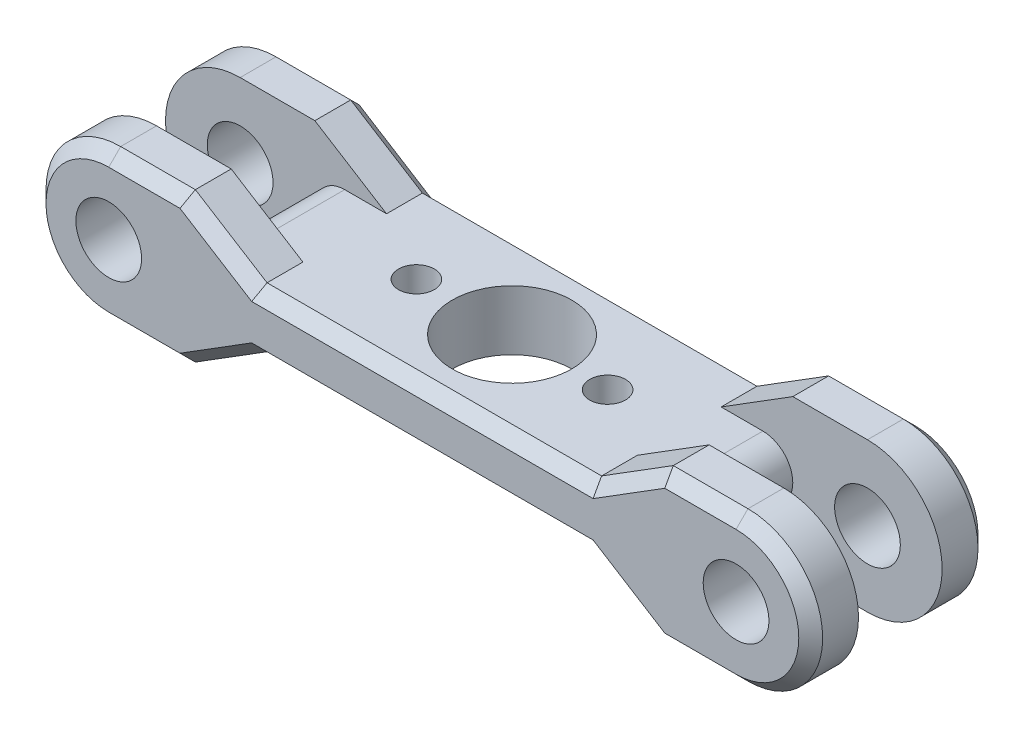
from build123d import *

# Parameters (mm, degrees)
SKETCH_1_W           = 40
SKETCH_1_H           = 15
EXTRUDE_1_DEPTH      = 5
CUT_EXTRUDE_START    = 5
SKETCH_2_R           = 5
SKETCH_2_R_2         = 1.5
CUT_EXTRUDE_1_DEPTH  = 5
EXTRUDE_3_DEPTH      = 8.75
EXTRUDE_3_DEPTH_BACK = 3.75
SKETCH_6_W           = 12.5
SKETCH_6_H           = 4
EXTRUDE_START        = 7.5
EXTRUDE_4_DEPTH      = 4
EXTRUDE_START_2      = -7.5
EXTRUDE_5_DEPTH      = 4
CUT_EXTRUDE_START_2  = 7.5
SKETCH_10_R          = 2.75
CUT_EXTRUDE_3_DEPTH  = 15
CUT_EXTRUDE_START_3  = -3.5
CUT_EXTRUDE_4_DEPTH  = 7
CHAMFER_1_SIZE       = 1


with BuildPart() as part:
    # 草图1 → 凸台-拉伸1 (new body)
    with BuildSketch(Plane(origin=(0, 0, 0), x_dir=(1, 0, 0), z_dir=(0, 1, 0))):
        Rectangle(SKETCH_1_W, SKETCH_1_H)
    extrude(amount=EXTRUDE_1_DEPTH)

    # 草图2 → 切除-拉伸1 (cut)
    with BuildSketch(Plane(origin=(0, 0, 0), x_dir=(1, 0, 0), z_dir=(0, 1, 0)).offset(CUT_EXTRUDE_START)):
        with Locations(Location((0, 0, 0), (0, 0, 90))):
            Circle(SKETCH_2_R)
        with Locations(Location((8, 0, 0), (0, 0, 90))):
            Circle(SKETCH_2_R_2)
        with Locations(Location((-8, 0, 0), (0, 0, 90))):
            Circle(SKETCH_2_R_2)
    extrude(amount=-CUT_EXTRUDE_1_DEPTH, mode=Mode.SUBTRACT)

    # 草图6 → 凸台-拉伸3 (add, two sides: drawn at the far end of the back side and taken through both)
    with BuildSketch(Plane(origin=(0, 0, 0), x_dir=(1, 0, 0), z_dir=(0, 1, 0)).offset(-EXTRUDE_3_DEPTH_BACK)):
        with Locations((26.25, 5.5)):
            Rectangle(SKETCH_6_W, SKETCH_6_H)
        with Locations((26.25, -5.5)):
            Rectangle(SKETCH_6_W, SKETCH_6_H)
        with Locations((-26.25, -5.5)):
            Rectangle(SKETCH_6_W, SKETCH_6_H)
        with Locations((-26.25, 5.5)):
            Rectangle(SKETCH_6_W, SKETCH_6_H)
    extrude(amount=EXTRUDE_3_DEPTH + EXTRUDE_3_DEPTH_BACK)

    # 草图8 → 凸台-拉伸4 (add)
    with BuildSketch(Plane.XY.offset(EXTRUDE_START)):
        Polygon((-20, -3.75), (-14, 0), (-20, 0), align=None)
        Polygon((-20, 8.75), (-14, 5), (-20, 5), align=None)
        Polygon((20, 0), (14, 0), (20, -3.75), align=None)
        Polygon((20, 5), (20, 8.75), (14, 5), align=None)
    extrude(amount=-EXTRUDE_4_DEPTH)

    # 草图9 → 凸台-拉伸5 (add)
    with BuildSketch(Plane.XY.offset(EXTRUDE_START_2)):
        Polygon((-14, 5), (-20, 8.75), (-20, 5), align=None)
        Polygon((-20, -3.75), (-14, 0), (-20, 0), align=None)
        Polygon((20, 5), (20, 8.75), (14, 5), align=None)
        Polygon((20, 0), (14, 0), (20, -3.75), align=None)
    extrude(amount=EXTRUDE_5_DEPTH)

    # 草图10 → 切除-拉伸3 (cut)
    with BuildSketch(Plane.XY.offset(CUT_EXTRUDE_START_2)):
        with BuildLine():
            Line((-32.5, 2.5), (-32.5, -3.75))
            Line((-32.5, -3.75), (-26.25, -3.75))
            ThreePointArc((-26.25, -3.75), (-30.669417382, -1.919417382), (-32.5, 2.5))
        make_face()
        with BuildLine():
            Line((-32.5, 8.75), (-32.5, 2.5))
            ThreePointArc((-32.5, 2.5), (-30.669417382, 6.919417382), (-26.25, 8.75))
            Line((-26.25, 8.75), (-32.5, 8.75))
        make_face()
        with Locations(Location((26.25, 2.5, 0), (0, 0, 180))):
            Circle(SKETCH_10_R)
        with BuildLine():
            ThreePointArc((32.5, 2.5), (30.669417382, -1.919417382), (26.25, -3.75))
            Line((26.25, -3.75), (32.5, -3.75))
            Line((32.5, -3.75), (32.5, 2.5))
        make_face()
        with BuildLine():
            ThreePointArc((26.25, 8.75), (30.669417382, 6.919417382), (32.5, 2.5))
            Line((32.5, 2.5), (32.5, 8.75))
            Line((32.5, 8.75), (26.25, 8.75))
        make_face()
        with Locations((-26.25, 2.5)):
            Circle(SKETCH_10_R)
    extrude(amount=-CUT_EXTRUDE_3_DEPTH, mode=Mode.SUBTRACT)

    # 草图11 → 切除-拉伸4 (cut)
    with BuildSketch(Plane.XY.offset(CUT_EXTRUDE_START_3)):
        with BuildLine():
            Line((20, 2.5), (20, 5))
            Line((20, 5), (17.5, 5))
            ThreePointArc((17.5, 5), (19.267766953, 4.267766953), (20, 2.5))
        make_face()
        with BuildLine():
            Line((20, 0), (20, 2.5))
            ThreePointArc((20, 2.5), (19.267766953, 0.732233047), (17.5, 0))
            Line((17.5, 0), (20, 0))
        make_face()
        with BuildLine():
            Line((-20, 0), (-17.5, 0))
            ThreePointArc((-17.5, 0), (-19.267766948, 0.732233042), (-20, 2.499999987))
            Line((-20, 2.499999987), (-20, 0))
        make_face()
        with BuildLine():
            Line((-20, 5), (-20, 2.499999987))
            ThreePointArc((-20, 2.499999987), (-19.267766958, 4.267766948), (-17.5, 5))
            Line((-17.5, 5), (-20, 5))
        make_face()
    extrude(amount=CUT_EXTRUDE_4_DEPTH, mode=Mode.SUBTRACT)

    # 倒角1
    chamfer_1_edges = [part.edges().sort_by_distance(p)[0] for p in [
        (17, -1.875, 7.5),
        (17, 6.875, 7.5),
        (-17, 6.875, -7.5),
        (-17, -1.875, -7.5),
        (0, 5, -7.5),
        (17, 6.875, -7.5),
        (0, 0, -7.5),
        (17, -1.875, -7.5),
        (-23.125, 8.75, 7.5),
        (23.125, -3.75, -7.5),
        (32.5, 2.5, 7.5),
        (32.5, 2.5, -7.5),
        (-32.5, 2.5, 7.5),
        (-32.5, 2.5, -7.5),
        (-23.125, -3.75, 7.5),
        (23.125, 8.75, -7.5),
        (23.125, -3.75, 7.5),
        (23.125, 8.75, 7.5),
        (-23.125, -3.75, -7.5),
        (-23.125, 8.75, -7.5),
        (0, 0, 7.5),
        (-17, -1.875, 7.5),
        (0, 5, 7.5),
        (-17, 6.875, 7.5),
    ]]
    chamfer(chamfer_1_edges, length=CHAMFER_1_SIZE)


solid = part.part
